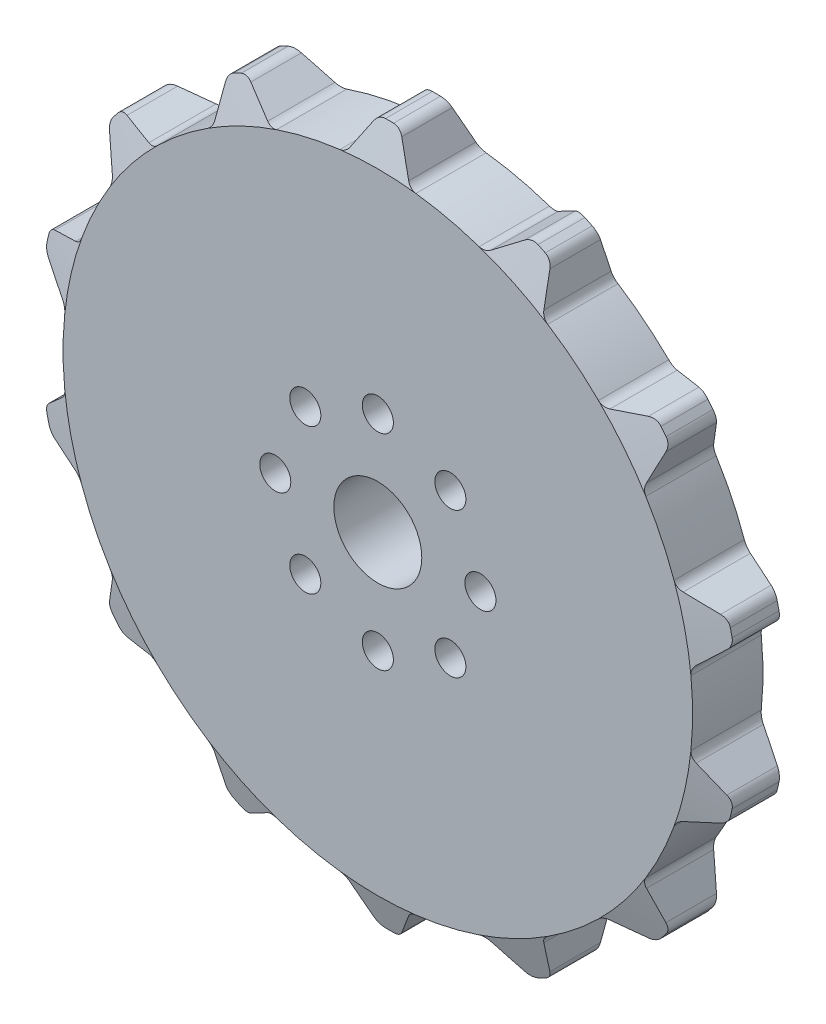
from build123d import *

# Parameters (mm, degrees)
SKETCH1_R                = 53.704277134
MAIN_BODY_DEPTH          = 6
TRACK_START              = -12
TRACK_TOOTH_DEPTH        = 12
FILLET5_R                = 2
CIRPATTERN4_COUNT        = 14
FILLET5_OF_CIRPATTERN4_R = 2
CUT_EXTRUDE1_REACH       = 86.501
SKETCH5_R                = 7.5
M5_CLEARANCE_HOLE1_D     = 5.3
CIRPATTERN9_COUNT        = 8


with BuildPart() as part:
    # Sketch1 → Main Body (new, symmetric)
    with BuildSketch(Plane.XY):
        Circle(SKETCH1_R)
    extrude(amount=MAIN_BODY_DEPTH, both=True)

    # Sketch2 → Track Tooth (add)
    with BuildSketch(Plane(origin=(0, 0, -6), x_dir=(-1, 0, 0), z_dir=(0, 0, -1)).offset(TRACK_START)):
        with BuildLine():
            Line((1.837205509, -59.766045995), (5.5, -53.421899839))
            ThreePointArc((5.5, -53.421899839), (2.753622021, -53.633636351), (0, -53.704277134))
            Line((0, -53.704277134), (0, -59.794277134))
            ThreePointArc((0, -59.794277134), (0.918711201, -59.787218932), (1.837205509, -59.766045995))
        make_face()
        with BuildLine():
            Line((0, -59.794277134), (0, -53.704277134))
            ThreePointArc((0, -53.704277134), (-2.753622021, -53.633636351), (-5.5, -53.421899839))
            Line((-5.5, -53.421899839), (-1.837205509, -59.766045995))
            ThreePointArc((-1.837205509, -59.766045995), (-0.918711201, -59.787218932), (0, -59.794277134))
        make_face()
    track_tooth = extrude(amount=TRACK_TOOTH_DEPTH)

    # Fillet5
    fillet5_edges = [part.edges().sort_by_distance(p)[0] for p in [
        (5.5, -53.421899839, 0),
        (-5.5, -53.421899839, 0),
        (-1.837205509, -59.766045995, 0),
        (1.837205509, -59.766045995, 0),
    ]]
    fillet(fillet5_edges, radius=FILLET5_R)

    # CirPattern4: Track Tooth ×14 about axis
    cirpattern4_axis = Axis((0, 0, 0), (0, 0, 1))
    for i in range(1, CIRPATTERN4_COUNT):
        add(track_tooth.rotate(cirpattern4_axis, i * 360 / CIRPATTERN4_COUNT))

    # Fillet5 of CirPattern4
    fillet5_of_cirpattern4_edges = [part.edges().sort_by_distance(p)[0] for p in [
        (28.134222426, -45.745108054, 0),
        (18.22356488, -50.517829185, 0),
        (24.276250541, -54.644480395, 0),
        (27.586780476, -53.050213203, 0),
        (45.196117058, -29.007936592, 0),
        (38.337729237, -37.608082899, 0),
        (45.581497442, -38.699905282, 0),
        (47.87245524, -35.827135068, 0),
        (53.306366412, -6.525387529, 0),
        (50.858636138, -17.249594563, 0),
        (57.858769755, -15.090339305, 0),
        (58.676403127, -11.508053442, 0),
        (50.858636138, 17.249594563, 0),
        (53.306366412, 6.525387529, 0),
        (58.676403127, 11.508053442, 0),
        (57.858769755, 15.090339305, 0),
        (38.337729237, 37.608082899, 0),
        (45.196117058, 29.007936592, 0),
        (47.87245524, 35.827135068, 0),
        (45.581497442, 38.699905282, 0),
        (18.22356488, 50.517829185, 0),
        (28.134222426, 45.745108054, 0),
        (27.586780476, 53.050213203, 0),
        (24.276250541, 54.644480395, 0),
        (-5.5, 53.421899839, 0),
        (5.5, 53.421899839, 0),
        (1.837205509, 59.766045995, 0),
        (-1.837205509, 59.766045995, 0),
        (-28.134222426, 45.745108054, 0),
        (-18.22356488, 50.517829185, 0),
        (-24.276250541, 54.644480395, 0),
        (-27.586780476, 53.050213203, 0),
        (-45.196117058, 29.007936592, 0),
        (-38.337729237, 37.608082899, 0),
        (-45.581497442, 38.699905282, 0),
        (-47.87245524, 35.827135068, 0),
        (-53.306366412, 6.525387529, 0),
        (-50.858636138, 17.249594563, 0),
        (-57.858769755, 15.090339305, 0),
        (-58.676403127, 11.508053442, 0),
        (-50.858636138, -17.249594563, 0),
        (-53.306366412, -6.525387529, 0),
        (-58.676403127, -11.508053442, 0),
        (-57.858769755, -15.090339305, 0),
        (-38.337729237, -37.608082899, 0),
        (-45.196117058, -29.007936592, 0),
        (-47.87245524, -35.827135068, 0),
        (-45.581497442, -38.699905282, 0),
        (-18.22356488, -50.517829185, 0),
        (-28.134222426, -45.745108054, 0),
        (-27.586780476, -53.050213203, 0),
        (-24.276250541, -54.644480395, 0),
    ]]
    fillet(fillet5_of_cirpattern4_edges, radius=FILLET5_OF_CIRPATTERN4_R)

    # Sketch3 → Cut-Revolve3 (revolve, cut)
    with BuildSketch(Plane(origin=(0, 0, 0), x_dir=(0, 0, -1), z_dir=(1, 0, 0))):
        Polygon((-6, -59.794277134), (-4, -59.794277134), (-6, -53.704277134), align=None)
        Polygon((4, -59.794277134), (6, -59.794277134), (6, -53.704277134), align=None)
    revolve(axis=Axis((0, 0, -5.5), (0, 0, 1)), mode=Mode.SUBTRACT)

    # Sketch5 → Cut-Extrude1 (cut, up to next)
    with BuildSketch(Plane(origin=(0, 0, -6), x_dir=(-1, 0, 0), z_dir=(0, 0, -1)), mode=Mode.PRIVATE) as cut_extrude1_sk1:
        Circle(SKETCH5_R)
    cut_extrude1_tool1 = extrude(cut_extrude1_sk1.sketch, amount=-CUT_EXTRUDE1_REACH, mode=Mode.PRIVATE) & part.part
    add(cut_extrude1_tool1.solids().sort_by_distance((0, 0, -6))[0], mode=Mode.SUBTRACT)

    # M5 Clearance Hole1 (through all)
    with Locations(Plane(origin=(0, 0, 6), x_dir=(-1, 0, 0), z_dir=(0, 0, 1))):
        with Locations((17.5, 0)):
            m5_clearance_hole1 = Hole(M5_CLEARANCE_HOLE1_D / 2)

    # CirPattern9: M5 Clearance Hole1 ×8 about axis
    cirpattern9_axis = Axis((0, 0, 0), (0, 0, 1))
    for i in range(1, CIRPATTERN9_COUNT):
        add(m5_clearance_hole1.rotate(cirpattern9_axis, i * 360 / CIRPATTERN9_COUNT), mode=Mode.SUBTRACT)


solid = part.part
